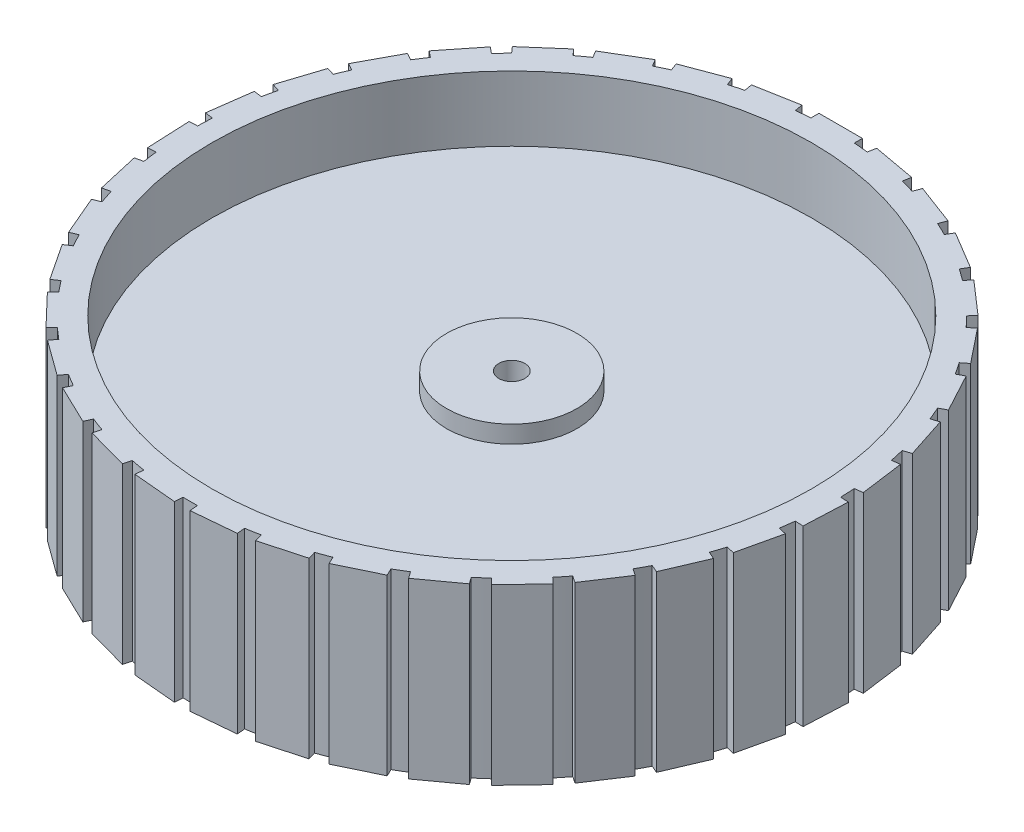
from build123d import *

# Parameters (mm, degrees)
SKETCH1_R           = 34.5
BOSS_EXTRUDE2_DEPTH = 2.5
SKETCH3_R           = 7.5
BOSS_EXTRUDE4_DEPTH = 2
SKETCH4_R           = 5
BOSS_EXTRUDE5_DEPTH = 15
SKETCH6_R           = 1.5
CUT_EXTRUDE1_DEPTH  = 54.521023906
SKETCH7_R           = 1.5
CUT_EXTRUDE3_DEPTH  = 7.5
SKETCH9_R           = 37
SKETCH9_R_2         = 34.5
BOSS_EXTRUDE7_DEPTH = 10
BOSS_EXTRUDE9_DEPTH = 20


with BuildPart() as part:
    # Sketch1 → Boss-Extrude2 (new, symmetric)
    with BuildSketch(Plane(origin=(0, 0, 0), x_dir=(1, 0, 0), z_dir=(0, 1, 0))):
        with Locations(Location((0, 0, 0), (0, 0, 270))):
            Circle(SKETCH1_R)
    extrude(amount=BOSS_EXTRUDE2_DEPTH, both=True)

    # Sketch3 → Boss-Extrude4 (add)
    with BuildSketch(Plane(origin=(0, 2.5, 0), x_dir=(1, 0, 0), z_dir=(0, 1, 0))):
        with Locations(Location((0, 0, 0), (0, 0, 270))):
            Circle(SKETCH3_R)
    extrude(amount=BOSS_EXTRUDE4_DEPTH)

    # Sketch4 → Boss-Extrude5 (add)
    with BuildSketch(Plane.XZ.offset(2.5)):
        with Locations(Location((0, 0, 0), (0, 0, 90))):
            Circle(SKETCH4_R)
    extrude(amount=BOSS_EXTRUDE5_DEPTH)

    # Sketch6 → Cut-Extrude1 (cut, through all)
    with BuildSketch(Plane(origin=(0, 4.5, 0), x_dir=(1, 0, 0), z_dir=(0, 1, 0))):
        with Locations(Location((0, 0, 0), (0, 0, 270))):
            Circle(SKETCH6_R)
    extrude(amount=-CUT_EXTRUDE1_DEPTH, mode=Mode.SUBTRACT)

    # Sketch7 → Cut-Extrude3 (cut, symmetric)
    with BuildSketch(Plane.XY):
        with Locations(Location((0, -10.5, 0), (0, 0, 270))):
            Circle(SKETCH7_R)
    extrude(amount=CUT_EXTRUDE3_DEPTH, both=True, mode=Mode.SUBTRACT)

    # Sketch9 → Boss-Extrude7 (add, symmetric)
    with BuildSketch(Plane(origin=(0, 0, 0), x_dir=(1, 0, 0), z_dir=(0, 1, 0))):
        with Locations(Location((0, 0, 0), (0, 0, 270))):
            Circle(SKETCH9_R)
        with Locations(Location((0, 0, 0), (0, 0, 270))):
            Circle(SKETCH9_R_2, mode=Mode.SUBTRACT)
    extrude(amount=BOSS_EXTRUDE7_DEPTH, both=True)

    # Sketch10 → Boss-Extrude9 (add)
    with BuildSketch(Plane(origin=(0, 10, 0), x_dir=(1, 0, 0), z_dir=(0, 1, 0))):
        with BuildLine():
            Line((2.497196139, 37.848039357), (-2.502803861, 37.848039357))
            Line((-2.502803861, 37.848039357), (-2.502803861, 36.848039357))
            add(Edge.make_bspline(
                [(-2.502803861, 36.848039357), (-1.250968074, 36.916823293), (0, 37)],
                knots=[0, 0, 0, 1, 1, 1], degree=2))
            add(Edge.make_bspline(
                [(2.497196139, 36.848039357), (1.250015261, 36.946448022), (0, 37)],
                knots=[0, 0, 0, 1, 1, 1], degree=2))
            Line((2.497196139, 36.848039357), (2.497196139, 37.848039357))
        make_face()
        with BuildLine():
            Line((9.215093552, 36.793914206), (4.295445609, 37.68669868))
            Line((4.295445609, 37.68669868), (4.116888714, 36.702769091))
            add(Edge.make_bspline(
                [(4.116888714, 36.702769091), (5.360888831, 36.54692373), (6.606605108, 36.405394778)],
                knots=[0, 0, 0, 1, 1, 1], degree=2))
            add(Edge.make_bspline(
                [(9.036536657, 35.809984617), (7.826970034, 36.129504559), (6.606605108, 36.405394778)],
                knots=[0, 0, 0, 1, 1, 1], degree=2))
            Line((9.036536657, 35.809984617), (9.215093552, 36.793914206))
        make_face()
        with BuildLine():
            Line((15.636810275, 34.557202378), (10.955635922, 36.314076498))
            Line((10.955635922, 36.314076498), (10.604261098, 35.377841627))
            add(Edge.make_bspline(
                [(10.604261098, 35.377841627), (11.800442358, 35.002375967), (13.000868491, 34.640690214)],
                knots=[0, 0, 0, 1, 1, 1], degree=2))
            add(Edge.make_bspline(
                [(15.285435451, 33.620967507), (14.15235955, 34.151329092), (13.000868491, 34.640690214)],
                knots=[0, 0, 0, 1, 1, 1], degree=2))
            Line((15.285435451, 33.620967507), (15.636810275, 34.557202378))
        make_face()
        with BuildLine():
            Line((21.555947051, 31.209793631), (17.263703083, 33.774290018))
            Line((17.263703083, 33.774290018), (16.750803805, 32.915841225))
            add(Edge.make_bspline(
                [(16.750803805, 32.915841225), (17.860719958, 32.332823041), (18.977273264, 31.762605363)],
                knots=[0, 0, 0, 1, 1, 1], degree=2))
            add(Edge.make_bspline(
                [(21.043047773, 30.351344838), (20.022880586, 31.075501808), (18.977273264, 31.762605363)],
                knots=[0, 0, 0, 1, 1, 1], degree=2))
            Line((21.043047773, 30.351344838), (21.555947051, 31.209793631))
        make_face()
        with BuildLine():
            Line((26.782257951, 26.859276438), (23.016900621, 30.148970068))
            Line((23.016900621, 30.148970068), (22.358961896, 29.395898602))
            add(Edge.make_bspline(
                [(22.358961896, 29.395898602), (23.346939322, 28.624066578), (24.34373286, 27.863644242)],
                knots=[0, 0, 0, 1, 1, 1], degree=2))
            add(Edge.make_bspline(
                [(26.124319226, 26.106204972), (25.249849765, 27.000882328), (24.34373286, 27.863644242)],
                knots=[0, 0, 0, 1, 1, 1], degree=2))
            Line((26.124319226, 26.106204972), (26.782257951, 26.859276438))
        make_face()
        with BuildLine():
            Line((31.147765045, 21.64548), (28.030316036, 25.554637413))
            Line((28.030316036, 25.554637413), (27.248484554, 24.931147611))
            add(Edge.make_bspline(
                [(27.248484554, 24.931147611), (28.082768847, 23.995309064), (28.927764851, 23.069122669)],
                knots=[0, 0, 0, 1, 1, 1], degree=2))
            add(Edge.make_bspline(
                [(30.365933563, 21.021990198), (29.665267996, 22.058432272), (28.927764851, 23.069122669)],
                knots=[0, 0, 0, 1, 1, 1], degree=2))
            Line((30.365933563, 21.021990198), (31.147765045, 21.64548))
        make_face()
        with BuildLine():
            Line((34.512157342, 15.735980025), (32.14281403, 20.138957685))
            Line((32.14281403, 20.138957685), (31.262218498, 19.665089022))
            add(Edge.make_bspline(
                [(31.262218498, 19.665089022), (31.915995074, 18.595322573), (32.582034679, 17.533140512)],
                knots=[0, 0, 0, 1, 1, 1], degree=2))
            add(Edge.make_bspline(
                [(33.63156181, 15.262111363), (33.127220106, 16.407006054), (32.582034679, 17.533140512)],
                knots=[0, 0, 0, 1, 1, 1], degree=2))
            Line((33.63156181, 15.262111363), (34.512157342, 15.735980025))
        make_face()
        with BuildLine():
            Line((36.767300505, 9.320712705), (35.222215533, 14.075995286))
            Line((35.222215533, 14.075995286), (34.271159017, 13.766978292))
            add(Edge.make_bspline(
                [(34.271159017, 13.766978292), (34.72341496, 12.597667114), (35.189091103, 11.433628792)],
                knots=[0, 0, 0, 1, 1, 1], degree=2))
            add(Edge.make_bspline(
                [(35.816243989, 9.01169571), (35.524436104, 10.228245161), (35.189091103, 11.433628792)],
                knots=[0, 0, 0, 1, 1, 1], degree=2))
            Line((35.816243989, 9.01169571), (36.767300505, 9.320712705))
        make_face()
        with BuildLine():
            Line((37.840712378, 2.605870009), (37.169546049, 7.560618818))
            Line((37.169546049, 7.560618818), (36.178596287, 7.426385552))
            add(Edge.make_bspline(
                [(36.178596287, 7.426385552), (36.414795718, 6.195112269), (36.665141185, 4.966630835)],
                knots=[0, 0, 0, 1, 1, 1], degree=2))
            add(Edge.make_bspline(
                [(36.849762616, 2.471636743), (36.779867496, 3.720740054), (36.665141185, 4.966630835)],
                knots=[0, 0, 0, 1, 1, 1], degree=2))
            Line((36.849762616, 2.471636743), (37.840712378, 2.605870009))
        make_face()
        with BuildLine():
            Line((37.697892619, -4.192727494), (37.922216771, 0.802237839))
            Line((37.922216771, 0.802237839), (36.923223704, 0.847102669))
            add(Edge.make_bspline(
                [(36.923223704, 0.847102669), (36.935774979, -0.406558582), (36.962743462, -1.659998723)],
                knots=[0, 0, 0, 1, 1, 1], degree=2))
            add(Edge.make_bspline(
                [(36.698899553, -4.147862663), (36.853163685, -2.906352701), (36.962743462, -1.659998723)],
                knots=[0, 0, 0, 1, 1, 1], degree=2))
            Line((36.698899553, -4.147862663), (37.697892619, -4.192727494))
        make_face()
        with BuildLine():
            Line((36.343431574, -10.856567284), (37.456036244, -5.981927723))
            Line((37.456036244, -5.981927723), (36.481108331, -5.75940679))
            add(Edge.make_bspline(
                [(36.481108331, -5.75940679), (36.269608042, -6.995162306), (36.072332751, -8.233274556)],
                knots=[0, 0, 0, 1, 1, 1], degree=2))
            add(Edge.make_bspline(
                [(35.368503662, -10.63404635), (35.741968869, -9.440032889), (36.072332751, -8.233274556)],
                knots=[0, 0, 0, 1, 1, 1], degree=2))
            Line((35.368503662, -10.63404635), (36.343431574, -10.856567284))
        make_face()
        with BuildLine():
            Line((33.820862734, -17.17146807), (35.785987892, -12.573829207))
            Line((35.785987892, -12.573829207), (34.86646012, -12.180804175))
            add(Edge.make_bspline(
                [(34.86646012, -12.180804175), (34.437706059, -13.358935757), (34.022527584, -14.541926171)],
                knots=[0, 0, 0, 1, 1, 1], degree=2))
            add(Edge.make_bspline(
                [(32.901334962, -16.778443038), (33.481997766, -15.670302652), (34.022527584, -14.541926171)],
                knots=[0, 0, 0, 1, 1, 1], degree=2))
            Line((32.901334962, -16.778443038), (33.820862734, -17.17146807))
        make_face()
        with BuildLine():
            Line((30.211263538, -22.934463743), (32.965748446, -18.761597474))
            Line((32.965748446, -18.761597474), (32.131175192, -18.210700493))
            add(Edge.make_bspline(
                [(32.131175192, -18.210700493), (31.498947868, -19.293342021), (30.879210388, -20.383188314)],
                knots=[0, 0, 0, 1, 1, 1], degree=2))
            add(Edge.make_bspline(
                [(29.376690285, -22.383566761), (30.145887705, -21.396915994), (30.879210388, -20.383188314)],
                knots=[0, 0, 0, 1, 1, 1], degree=2))
            Line((29.376690285, -22.383566761), (30.211263538, -22.934463743))
        make_face()
        with BuildLine():
            Line((25.630649475, -27.960326881), (29.08596272, -24.346352561))
            Line((29.08596272, -24.346352561), (28.363167856, -23.655289912))
            add(Edge.make_bspline(
                [(28.363167856, -23.655289912), (27.547787576, -24.607644399), (26.743409962, -25.569318013)],
                knots=[0, 0, 0, 1, 1, 1], degree=2))
            add(Edge.make_bspline(
                [(24.907854611, -27.269264232), (25.84086401, -26.435814851), (26.743409962, -25.569318013)],
                knots=[0, 0, 0, 1, 1, 1], degree=2))
            Line((24.907854611, -27.269264232), (25.630649475, -27.960326881))
        make_face()
        with BuildLine():
            Line((20.226245248, -32.087522107), (24.27133022, -29.148595845))
            Line((24.27133022, -29.148595845), (23.683544967, -28.339578851))
            add(Edge.make_bspline(
                [(23.683544967, -28.339578851), (22.711218724, -29.131036838), (21.748054335, -29.933628792)],
                knots=[0, 0, 0, 1, 1, 1], degree=2))
            add(Edge.make_bspline(
                [(19.638459995, -31.278505112), (20.705293683, -30.625044867), (21.748054335, -29.933628792)],
                knots=[0, 0, 0, 1, 1, 1], degree=2))
            Line((19.638459995, -31.278505112), (20.226245248, -32.087522107))
        make_face()
        with BuildLine():
            Line((14.171752856, -35.18339797), (18.676597196, -33.013979275))
            Line((18.676597196, -33.013979275), (18.242713457, -32.113010407))
            add(Edge.make_bspline(
                [(18.242713457, -32.113010407), (17.144692616, -32.718133784), (16.053698347, -33.335848112)],
                knots=[0, 0, 0, 1, 1, 1], degree=2))
            add(Edge.make_bspline(
                [(13.737869117, -34.282429102), (14.904238181, -33.829960743), (16.053698347, -33.335848112)],
                knots=[0, 0, 0, 1, 1, 1], degree=2))
            Line((13.737869117, -34.282429102), (14.171752856, -35.18339797))
        make_face()
        with BuildLine():
            Line((7.661768668, -37.148450474), (12.481582971, -35.818266246))
            Line((12.481582971, -35.818266246), (12.215546126, -34.854303386))
            add(Edge.make_bspline(
                [(12.215546126, -34.854303386), (11.02712198, -35.253642989), (9.843363286, -35.666625846)],
                knots=[0, 0, 0, 1, 1, 1], degree=2))
            add(Edge.make_bspline(
                [(7.395731822, -36.184487614), (8.6241482, -35.947553845), (9.843363286, -35.666625846)],
                knots=[0, 0, 0, 1, 1, 1], degree=2))
            Line((7.395731822, -36.184487614), (7.661768668, -37.148450474))
        make_face()
        with BuildLine():
            Line((0.90552893, -37.919521214), (5.8854004, -37.47132467))
            Line((5.8854004, -37.47132467), (5.795761091, -36.475350376))
            add(Edge.make_bspline(
                [(5.795761091, -36.475350376), (4.555130571, -36.656071102), (3.316654429, -36.851048878)],
                knots=[0, 0, 0, 1, 1, 1], degree=2))
            add(Edge.make_bspline(
                [(0.815889621, -36.92354692), (2.066871, -36.909762988), (3.316654429, -36.851048878)],
                knots=[0, 0, 0, 1, 1, 1], degree=2))
            Line((0.815889621, -36.92354692), (0.90552893, -37.919521214))
        make_face()
        with BuildLine():
            Line((-5.879815253, -37.471827342), (-0.899943783, -37.920023887))
            Line((-0.899943783, -37.920023887), (-0.810304474, -36.924049593))
            add(Edge.make_bspline(
                [(-0.810304474, -36.924049593), (-2.063266483, -36.880342929), (-3.316654429, -36.851048878)],
                knots=[0, 0, 0, 1, 1, 1], degree=2))
            add(Edge.make_bspline(
                [(-5.790175944, -36.475853048), (-4.556837134, -36.68566198), (-3.316654429, -36.851048878)],
                knots=[0, 0, 0, 1, 1, 1], degree=2))
            Line((-5.790175944, -36.475853048), (-5.879815253, -37.471827342))
        make_face()
        with BuildLine():
            Line((-12.476177335, -35.819758107), (-7.656363032, -37.149942335))
            Line((-7.656363032, -37.149942335), (-7.390326186, -36.185979474))
            add(Edge.make_bspline(
                [(-7.390326186, -36.185979474), (-8.615348454, -35.91925019), (-9.843363286, -35.666625846)],
                knots=[0, 0, 0, 1, 1, 1], degree=2))
            add(Edge.make_bspline(
                [(-12.21014049, -34.855795246), (-11.034084773, -35.282453611), (-9.843363286, -35.666625846)],
                knots=[0, 0, 0, 1, 1, 1], degree=2))
            Line((-12.21014049, -34.855795246), (-12.476177335, -35.819758107))
        make_face()
        with BuildLine():
            Line((-18.671544813, -33.016412374), (-14.166700473, -35.18583107))
            Line((-14.166700473, -35.18583107), (-13.732816734, -34.284862202))
            add(Edge.make_bspline(
                [(-13.732816734, -34.284862202), (-14.890526038, -33.803683194), (-16.053698347, -33.335848112)],
                knots=[0, 0, 0, 1, 1, 1], degree=2))
            add(Edge.make_bspline(
                [(-18.237661074, -32.115443506), (-17.156687849, -32.745238152), (-16.053698347, -33.335848112)],
                knots=[0, 0, 0, 1, 1, 1], degree=2))
            Line((-18.237661074, -32.115443506), (-18.671544813, -33.016412374))
        make_face()
        with BuildLine():
            Line((-24.266793477, -29.151891981), (-20.221708505, -32.090818243))
            Line((-20.221708505, -32.090818243), (-19.633923253, -31.281801248))
            add(Edge.make_bspline(
                [(-19.633923253, -31.281801248), (-20.687109862, -30.601638007), (-21.748054335, -29.933628792)],
                knots=[0, 0, 0, 1, 1, 1], degree=2))
            add(Edge.make_bspline(
                [(-23.679008225, -28.342874987), (-22.727860861, -29.155563796), (-21.748054335, -29.933628792)],
                knots=[0, 0, 0, 1, 1, 1], degree=2))
            Line((-23.679008225, -28.342874987), (-24.266793477, -29.151891981))
        make_face()
        with BuildLine():
            Line((-29.082087432, -24.350405794), (-25.626774187, -27.964380113))
            Line((-25.626774187, -27.964380113), (-24.903979324, -27.273317464))
            add(Edge.make_bspline(
                [(-24.903979324, -27.273317464), (-25.818792954, -26.416030995), (-26.743409962, -25.569318013)],
                knots=[0, 0, 0, 1, 1, 1], degree=2))
            add(Edge.make_bspline(
                [(-28.359292569, -23.659343145), (-27.568541724, -24.628805631), (-26.743409962, -25.569318013)],
                knots=[0, 0, 0, 1, 1, 1], degree=2))
            Line((-28.359292569, -23.659343145), (-29.082087432, -24.350405794))
        make_face()
        with BuildLine():
            Line((-32.962659169, -18.766277529), (-30.208174261, -22.939143798))
            Line((-30.208174261, -22.939143798), (-29.373601008, -22.388246816))
            add(Edge.make_bspline(
                [(-29.373601008, -22.388246816), (-30.120638797, -21.381391012), (-30.879210388, -20.383188314)],
                knots=[0, 0, 0, 1, 1, 1], degree=2))
            add(Edge.make_bspline(
                [(-32.128085915, -18.215380548), (-31.523146973, -19.310457387), (-30.879210388, -20.383188314)],
                knots=[0, 0, 0, 1, 1, 1], degree=2))
            Line((-32.128085915, -18.215380548), (-32.962659169, -18.766277529))
        make_face()
        with BuildLine():
            Line((-35.783783917, -12.578985663), (-33.818658759, -17.176624526))
            Line((-33.818658759, -17.176624526), (-32.899130987, -16.783599494))
            add(Edge.make_bspline(
                [(-32.899130987, -16.783599494), (-33.454382526, -15.65953553), (-34.022527584, -14.541926171)],
                knots=[0, 0, 0, 1, 1, 1], degree=2))
            add(Edge.make_bspline(
                [(-34.864256145, -12.185960631), (-34.464572341, -13.371455155), (-34.022527584, -14.541926171)],
                knots=[0, 0, 0, 1, 1, 1], degree=2))
            Line((-34.864256145, -12.185960631), (-35.783783917, -12.578985663))
        make_face()
        with BuildLine():
            Line((-37.454788408, -5.987394848), (-36.342183738, -10.862034409))
            Line((-36.342183738, -10.862034409), (-35.367255826, -10.639513475))
            add(Edge.make_bspline(
                [(-35.367255826, -10.639513475), (-35.712874873, -9.43436969), (-36.072332751, -8.233274556)],
                knots=[0, 0, 0, 1, 1, 1], degree=2))
            add(Edge.make_bspline(
                [(-36.479860496, -5.764873914), (-36.298277996, -7.002683352), (-36.072332751, -8.233274556)],
                knots=[0, 0, 0, 1, 1, 1], degree=2))
            Line((-36.479860496, -5.764873914), (-37.454788408, -5.987394848))
        make_face()
        with BuildLine():
            Line((-37.921965181, 0.796635764), (-37.69764103, -4.198329569))
            Line((-37.69764103, -4.198329569), (-36.698647963, -4.153464739))
            add(Edge.make_bspline(
                [(-36.698647963, -4.153464739), (-36.823526038, -2.905975446), (-36.962743462, -1.659998723)],
                knots=[0, 0, 0, 1, 1, 1], degree=2))
            add(Edge.make_bspline(
                [(-36.922972115, 0.841500594), (-36.96532713, -0.408839544), (-36.962743462, -1.659998723)],
                knots=[0, 0, 0, 1, 1, 1], degree=2))
            Line((-36.922972115, 0.841500594), (-37.921965181, 0.796635764))
        make_face()
        with BuildLine():
            Line((-37.170298791, 7.555061847), (-37.841465121, 2.600313038))
            Line((-37.841465121, 2.600313038), (-36.850515359, 2.466079772))
            add(Edge.make_bspline(
                [(-36.850515359, 2.466079772), (-36.750638777, 3.71581924), (-36.665141185, 4.966630835)],
                knots=[0, 0, 0, 1, 1, 1], degree=2))
            add(Edge.make_bspline(
                [(-36.17934903, 7.420828581), (-36.444280235, 6.198144703), (-36.665141185, 4.966630835)],
                knots=[0, 0, 0, 1, 1, 1], degree=2))
            Line((-36.17934903, 7.420828581), (-37.170298791, 7.555061847))
        make_face()
        with BuildLine():
            Line((-35.223948415, 14.070662026), (-36.769033386, 9.315379444))
            Line((-36.769033386, 9.315379444), (-35.81797687, 9.00636245))
            add(Edge.make_bspline(
                [(-35.81797687, 9.00636245), (-35.496555748, 10.218184438), (-35.189091103, 11.433628792)],
                knots=[0, 0, 0, 1, 1, 1], degree=2))
            add(Edge.make_bspline(
                [(-34.272891898, 13.761645031), (-34.751884187, 12.60591548), (-35.189091103, 11.433628792)],
                knots=[0, 0, 0, 1, 1, 1], degree=2))
            Line((-34.272891898, 13.761645031), (-35.223948415, 14.070662026))
        make_face()
        with BuildLine():
            Line((-32.145471353, 20.13401955), (-34.514814666, 15.73104189))
            Line((-34.514814666, 15.73104189), (-33.634219134, 15.257173228))
            add(Edge.make_bspline(
                [(-33.634219134, 15.257173228), (-33.10158421, 16.392128781), (-32.582034679, 17.533140512)],
                knots=[0, 0, 0, 1, 1, 1], degree=2))
            add(Edge.make_bspline(
                [(-31.264875821, 19.660150887), (-31.942533987, 18.608521761), (-32.582034679, 17.533140512)],
                knots=[0, 0, 0, 1, 1, 1], degree=2))
            Line((-31.264875821, 19.660150887), (-32.145471353, 20.13401955))
        make_face()
        with BuildLine():
            Line((-28.033812393, 25.550253119), (-31.151261403, 21.641095707))
            Line((-31.151261403, 21.641095707), (-30.36942992, 21.017605905))
            add(Edge.make_bspline(
                [(-30.36942992, 21.017605905), (-29.64270052, 22.039216617), (-28.927764851, 23.069122669)],
                knots=[0, 0, 0, 1, 1, 1], degree=2))
            add(Edge.make_bspline(
                [(-27.251980911, 24.926763317), (-28.106524462, 24.013034841), (-28.927764851, 23.069122669)],
                knots=[0, 0, 0, 1, 1, 1], degree=2))
            Line((-27.251980911, 24.926763317), (-28.033812393, 25.550253119))
        make_face()
        with BuildLine():
            Line((-23.021123637, 30.14528053), (-26.786480967, 26.855586901))
            Line((-26.786480967, 26.855586901), (-26.128542241, 26.102515435))
            add(Edge.make_bspline(
                [(-26.128542241, 26.102515435), (-25.231076044, 26.977945897), (-24.34373286, 27.863644242)],
                knots=[0, 0, 0, 1, 1, 1], degree=2))
            add(Edge.make_bspline(
                [(-22.363184911, 29.392209064), (-23.367148115, 28.645749224), (-24.34373286, 27.863644242)],
                knots=[0, 0, 0, 1, 1, 1], degree=2))
            Line((-22.363184911, 29.392209064), (-23.021123637, 30.14528053))
        make_face()
        with BuildLine():
            Line((-17.268517025, 33.771413822), (-21.560760993, 31.206917435))
            Line((-21.560760993, 31.206917435), (-21.047861715, 30.348468641))
            add(Edge.make_bspline(
                [(-21.047861715, 30.348468641), (-20.008504025, 31.049581799), (-18.977273264, 31.762605363)],
                knots=[0, 0, 0, 1, 1, 1], degree=2))
            add(Edge.make_bspline(
                [(-16.755617747, 32.912965028), (-17.876732401, 32.357765656), (-18.977273264, 31.762605363)],
                knots=[0, 0, 0, 1, 1, 1], degree=2))
            Line((-16.755617747, 32.912965028), (-17.268517025, 33.771413822))
        make_face()
        with BuildLine():
            Line((-10.960886067, 36.312106086), (-15.64206042, 34.555231965))
            Line((-15.64206042, 34.555231965), (-15.290685596, 33.618997095))
            add(Edge.make_bspline(
                [(-15.290685596, 33.618997095), (-14.142842223, 34.123258593), (-13.000868491, 34.640690214)],
                knots=[0, 0, 0, 1, 1, 1], degree=2))
            add(Edge.make_bspline(
                [(-10.609511243, 35.375871215), (-11.811743798, 35.029776877), (-13.000868491, 34.640690214)],
                knots=[0, 0, 0, 1, 1, 1], degree=2))
            Line((-10.609511243, 35.375871215), (-10.960886067, 36.312106086))
        make_face()
        with BuildLine():
            Line((-4.300963212, 37.685697383), (-9.220611155, 36.792912909))
            Line((-9.220611155, 36.792912909), (-9.04205426, 35.80898332))
            add(Edge.make_bspline(
                [(-9.04205426, 35.80898332), (-7.822617835, 36.10018578), (-6.606605108, 36.405394778)],
                knots=[0, 0, 0, 1, 1, 1], degree=2))
            add(Edge.make_bspline(
                [(-4.122406317, 36.701767794), (-5.367116031, 36.575902246), (-6.606605108, 36.405394778)],
                knots=[0, 0, 0, 1, 1, 1], degree=2))
            Line((-4.122406317, 36.701767794), (-4.300963212, 37.685697383))
        make_face()
    extrude(amount=-BOSS_EXTRUDE9_DEPTH)


solid = part.part
